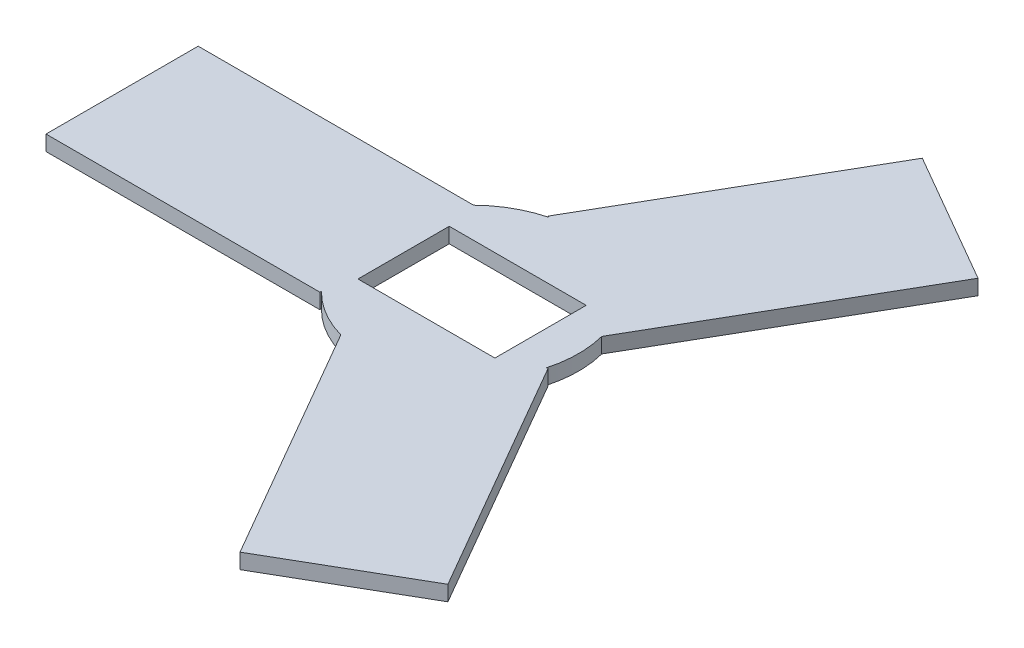
from build123d import *

# Parameters (mm, degrees)
ESQUISSE3_R             = 35
BOSS_EXTRU_3_DEPTH      = 5
ESQUISSE4_W             = 45
ESQUISSE4_H             = 30
ENL_V_MAT_EXTRU_1_DEPTH = 161.669919512


with BuildPart() as part:
    # Esquisse3 → Boss.-Extru.3 (new body)
    with BuildSketch(Plane(origin=(0, 0, 0), x_dir=(1, 0, 0), z_dir=(0, 1, 0))):
        with BuildLine():
            Line((-115, -25), (-25, -25))
            Line((-25, -25), (-24.99494949, -24.500051021))
            ThreePointArc((-24.99494949, -24.500051021), (-34.998214236, 0.353553761), (-24.494897428, 25))
            Line((-24.494897428, 25), (-25, 25))
            Line((-25, 25), (-115, 25))
            Line((-115, 25), (-115, -25))
        make_face()
        Circle(ESQUISSE3_R)
        Polygon((-9.403186381, -33.713203436), (35.849364905, -112.092921435), (79.150635095, -87.092921435), (34.150635095, -9.150635095), align=None)
        with BuildLine():
            Line((-24.494897428, 25), (-24.99494949, -24.500051021))
            ThreePointArc((-24.99494949, -24.500051021), (-17.805293657, -30.132565736), (-9.403186381, -33.713203436))
            Line((-9.403186381, -33.713203436), (33.715141323, -9.396235714))
            ThreePointArc((33.715141323, -9.396235714), (34.677297662, -4.741837919), (35, 0))
            ThreePointArc((35, 0), (34.72342821, 4.391302011), (33.898083809, 8.713203436))
            Line((33.898083809, 8.713203436), (-8.720191833, 33.896286735))
            ThreePointArc((-8.720191833, 33.896286735), (-17.19292058, 30.486119496), (-24.494897428, 25))
        make_face()
        Circle(ESQUISSE3_R)
        Polygon((33.898083809, 8.713203436), (79.150635095, 87.092921435), (35.849364905, 112.092921435), (-9.150635095, 34.150635095), align=None)
        with BuildLine():
            ThreePointArc((33.898083809, 8.713203436), (17.805293657, 30.132565736), (-8.720191833, 33.896286735))
            Line((-8.720191833, 33.896286735), (33.898083809, 8.713203436))
        make_face()
    extrude(amount=BOSS_EXTRU_3_DEPTH)

    # Esquisse4 → Enlèv. mat.-Extru.1 (cut, through all)
    with BuildSketch(Plane(origin=(0, 5, 0), x_dir=(1, 0, 0), z_dir=(0, 1, 0))):
        Rectangle(ESQUISSE4_W, ESQUISSE4_H)
    extrude(amount=-ENL_V_MAT_EXTRU_1_DEPTH, mode=Mode.SUBTRACT)


solid = part.part
